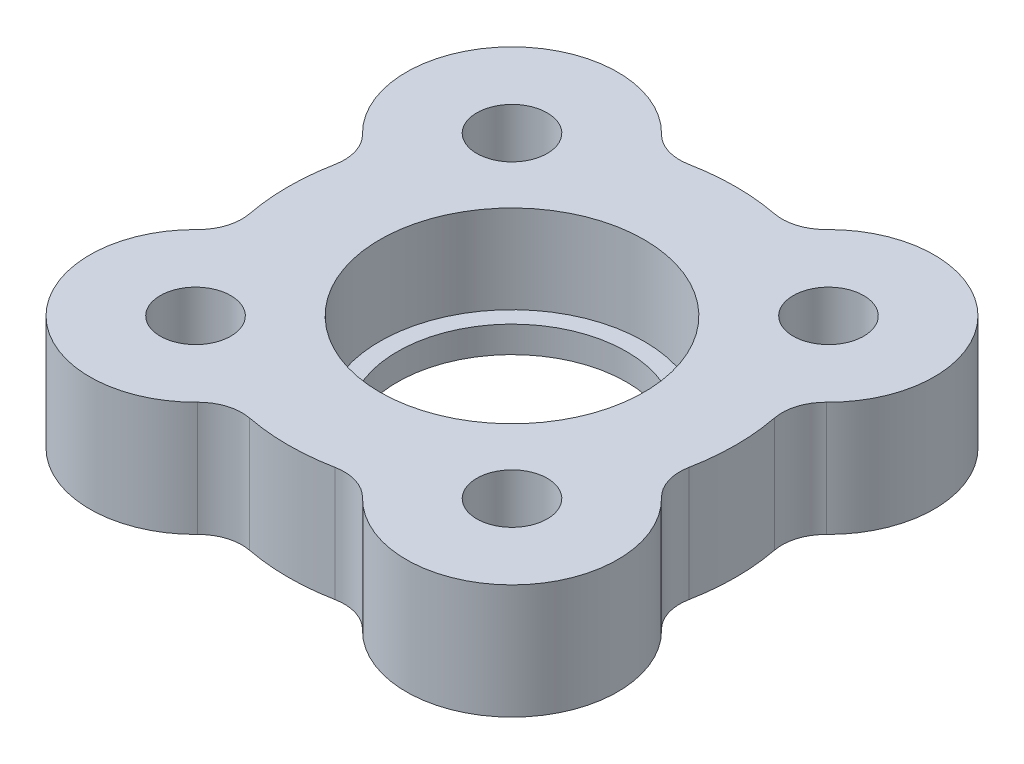
from build123d import *

# Parameters (mm, degrees)
SKETCH1_R                 = 4
SKETCH1_R_2               = 13
BODY_AND_MAIN_HOLES_DEPTH = 13
SKETCH3_R                 = 15
BEARING_HOLE_DEPTH        = 10


with BuildPart() as part:
    # Sketch1 → body and main holes (new body)
    with BuildSketch(Plane(origin=(0, 0, 0), x_dir=(1, 0, 0), z_dir=(0, 1, 0))):
        with BuildLine():
            ThreePointArc((-9.377544991, 26.346969967), (-26.445793616, 26.445793616), (-26.346969967, 9.377544991))
            ThreePointArc((-26.346969967, 9.377544991), (-25.068329757, 7.290769599), (-24.9332143, 4.847146031))
            ThreePointArc((-24.9332143, 4.847146031), (-25.4, 0), (-24.9332143, -4.847146031))
            ThreePointArc((-24.9332143, -4.847146031), (-25.068329757, -7.290769599), (-26.346969967, -9.377544991))
            ThreePointArc((-26.346969967, -9.377544991), (-26.445793616, -26.445793616), (-9.377544991, -26.346969967))
            ThreePointArc((-9.377544991, -26.346969967), (-7.290769599, -25.068329757), (-4.847146031, -24.9332143))
            ThreePointArc((-4.847146031, -24.9332143), (0, -25.4), (4.847146031, -24.9332143))
            ThreePointArc((4.847146031, -24.9332143), (7.290769599, -25.068329757), (9.377544991, -26.346969967))
            ThreePointArc((9.377544991, -26.346969967), (26.445793616, -26.445793616), (26.346969967, -9.377544991))
            ThreePointArc((26.346969967, -9.377544991), (25.068329757, -7.290769599), (24.9332143, -4.847146031))
            ThreePointArc((24.9332143, -4.847146031), (25.4, 0), (24.9332143, 4.847146031))
            ThreePointArc((24.9332143, 4.847146031), (25.068329757, 7.290769599), (26.346969967, 9.377544991))
            ThreePointArc((26.346969967, 9.377544991), (26.445793616, 26.445793616), (9.377544991, 26.346969967))
            ThreePointArc((9.377544991, 26.346969967), (7.290769599, 25.068329757), (4.847146031, 24.9332143))
            ThreePointArc((4.847146031, 24.9332143), (0, 25.4), (-4.847146031, 24.9332143))
            ThreePointArc((-4.847146031, 24.9332143), (-7.290769599, 25.068329757), (-9.377544991, 26.346969967))
        make_face()
        with Locations(Location((-17.960512242, 17.960512242, 0), (0, 0, 90))):
            Circle(SKETCH1_R, mode=Mode.SUBTRACT)
        with Locations(Location((17.960512242, 17.960512242, 0), (0, 0, 90))):
            Circle(SKETCH1_R, mode=Mode.SUBTRACT)
        with Locations(Location((17.960512242, -17.960512242, 0), (0, 0, 90))):
            Circle(SKETCH1_R, mode=Mode.SUBTRACT)
        with Locations(Location((-17.960512242, -17.960512242, 0), (0, 0, 90))):
            Circle(SKETCH1_R, mode=Mode.SUBTRACT)
        with Locations(Location((0, 0, 0), (0, 0, 90))):
            Circle(SKETCH1_R_2, mode=Mode.SUBTRACT)
    extrude(amount=BODY_AND_MAIN_HOLES_DEPTH)

    # Sketch3 → bearing hole (cut)
    with BuildSketch(Plane.XZ.offset(-13)):
        with Locations(Location((0, 0, 0), (0, 0, 270))):
            Circle(SKETCH3_R)
    extrude(amount=BEARING_HOLE_DEPTH, mode=Mode.SUBTRACT)


solid = part.part
